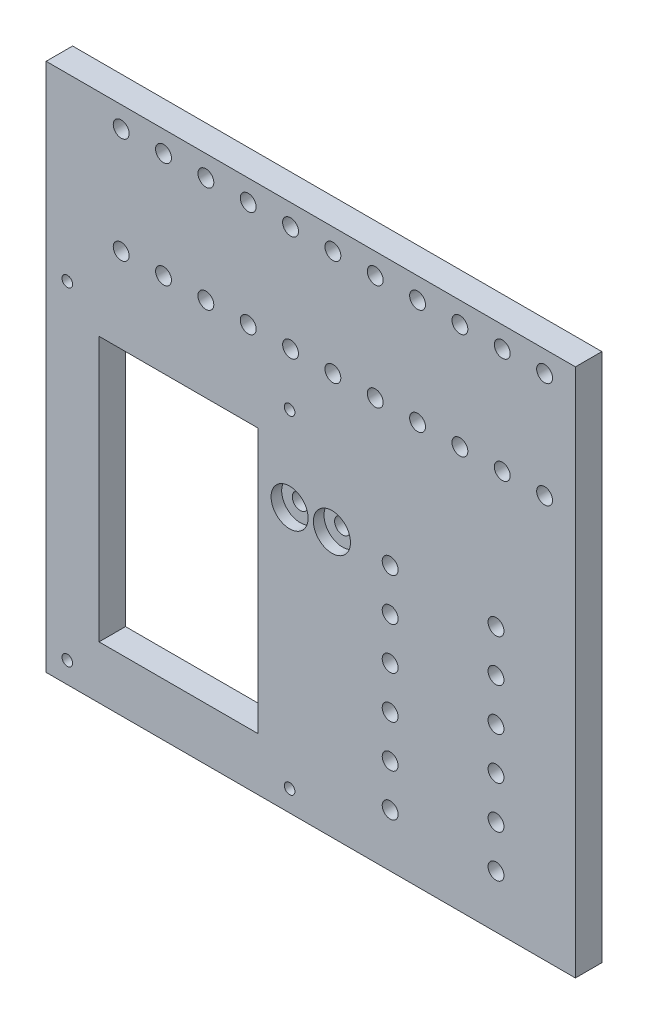
from build123d import *

# Parameters (mm, degrees)
SKETCH_1_W          = 100
SKETCH_1_H          = 100
SKETCH_1_R          = 1.5
EXTRUDE_1_DEPTH     = 5
SKETCH_2_R          = 1
CUT_EXTRUDE_1_DEPTH = 71.887234394
SKETCH_3_R          = 3.5
CUT_EXTRUDE_2_DEPTH = 2
SKETCH_4_R          = 1.5
CUT_EXTRUDE_3_DEPTH = 10
SKETCH_5_R          = 1.5
CUT_EXTRUDE_4_DEPTH = 10
SKETCH_6_W          = 30
SKETCH_6_H          = 50
CUT_EXTRUDE_5_DEPTH = 10


with BuildPart() as part:
    # 草图1 → 凸台-拉伸1 (new body)
    with BuildSketch(Plane.XY):
        Rectangle(SKETCH_1_W, SKETCH_1_H)
        with Locations((-4, 0)):
            Circle(SKETCH_1_R, mode=Mode.SUBTRACT)
        with Locations(Location((4, 0, 0), (0, 0, 180))):
            Circle(SKETCH_1_R, mode=Mode.SUBTRACT)
    extrude(amount=EXTRUDE_1_DEPTH)

    # 草图2 → 切除-拉伸1 (cut, through all)
    with BuildSketch(Plane.XY.offset(5)):
        with Locations(Location((-46, -46, 0), (0, 0, 180))):
            Circle(SKETCH_2_R)
        with Locations((-46, 16)):
            Circle(SKETCH_2_R)
        with Locations((-4, -46)):
            Circle(SKETCH_2_R)
        with Locations((-4, 16)):
            Circle(SKETCH_2_R)
    extrude(amount=-CUT_EXTRUDE_1_DEPTH, mode=Mode.SUBTRACT)

    # 草图3 → 切除-拉伸2 (cut)
    with BuildSketch(Plane.XY.offset(5)):
        with Locations((-4, 0)):
            Circle(SKETCH_3_R)
        with Locations((4, 0)):
            Circle(SKETCH_3_R)
    extrude(amount=-CUT_EXTRUDE_2_DEPTH, mode=Mode.SUBTRACT)

    # 草图4 → 切除-拉伸3 (cut)
    with BuildSketch(Plane.XY.offset(5)):
        with Locations((35, 0)):
            Circle(SKETCH_4_R)
        with Locations((15, 0)):
            Circle(SKETCH_4_R)
        with Locations((35, -8)):
            Circle(SKETCH_4_R)
        with Locations((15, -8)):
            Circle(SKETCH_4_R)
        with Locations((35, -16)):
            Circle(SKETCH_4_R)
        with Locations((15, -16)):
            Circle(SKETCH_4_R)
        with Locations((35, -24)):
            Circle(SKETCH_4_R)
        with Locations((15, -24)):
            Circle(SKETCH_4_R)
        with Locations((35, -32)):
            Circle(SKETCH_4_R)
        with Locations((15, -32)):
            Circle(SKETCH_4_R)
        with Locations((35, -40)):
            Circle(SKETCH_4_R)
        with Locations((15, -40)):
            Circle(SKETCH_4_R)
    extrude(amount=-CUT_EXTRUDE_3_DEPTH, mode=Mode.SUBTRACT)

    # 草图5 → 切除-拉伸4 (cut)
    with BuildSketch(Plane(origin=(0, 0, 0), x_dir=(-1, 0, 0), z_dir=(0, 0, -1))):
        with Locations((35.821699256, 46)):
            Circle(SKETCH_5_R)
        with Locations((35.821699256, 26)):
            Circle(SKETCH_5_R)
        with Locations((27.821699256, 46)):
            Circle(SKETCH_5_R)
        with Locations((27.821699256, 26)):
            Circle(SKETCH_5_R)
        with Locations((19.821699256, 46)):
            Circle(SKETCH_5_R)
        with Locations((19.821699256, 26)):
            Circle(SKETCH_5_R)
        with Locations((11.821699256, 46)):
            Circle(SKETCH_5_R)
        with Locations((11.821699256, 26)):
            Circle(SKETCH_5_R)
        with Locations((3.821699256, 46)):
            Circle(SKETCH_5_R)
        with Locations((3.821699256, 26)):
            Circle(SKETCH_5_R)
        with Locations((-4.178300744, 46)):
            Circle(SKETCH_5_R)
        with Locations((-4.178300744, 26)):
            Circle(SKETCH_5_R)
        with Locations((-12.178300744, 46)):
            Circle(SKETCH_5_R)
        with Locations((-12.178300744, 26)):
            Circle(SKETCH_5_R)
        with Locations((-20.178300744, 46)):
            Circle(SKETCH_5_R)
        with Locations((-20.178300744, 26)):
            Circle(SKETCH_5_R)
        with Locations((-28.178300744, 46)):
            Circle(SKETCH_5_R)
        with Locations((-28.178300744, 26)):
            Circle(SKETCH_5_R)
        with Locations((-36.178300744, 46)):
            Circle(SKETCH_5_R)
        with Locations((-36.178300744, 26)):
            Circle(SKETCH_5_R)
        with Locations((-44.178300744, 46)):
            Circle(SKETCH_5_R)
        with Locations((-44.178300744, 26)):
            Circle(SKETCH_5_R)
    extrude(amount=-CUT_EXTRUDE_4_DEPTH, mode=Mode.SUBTRACT)

    # 草图6 → 切除-拉伸5 (cut)
    with BuildSketch(Plane(origin=(0, 0, 0), x_dir=(-1, 0, 0), z_dir=(0, 0, -1))):
        with Locations((25, -15)):
            Rectangle(SKETCH_6_W, SKETCH_6_H)
    extrude(amount=-CUT_EXTRUDE_5_DEPTH, mode=Mode.SUBTRACT)


solid = part.part
